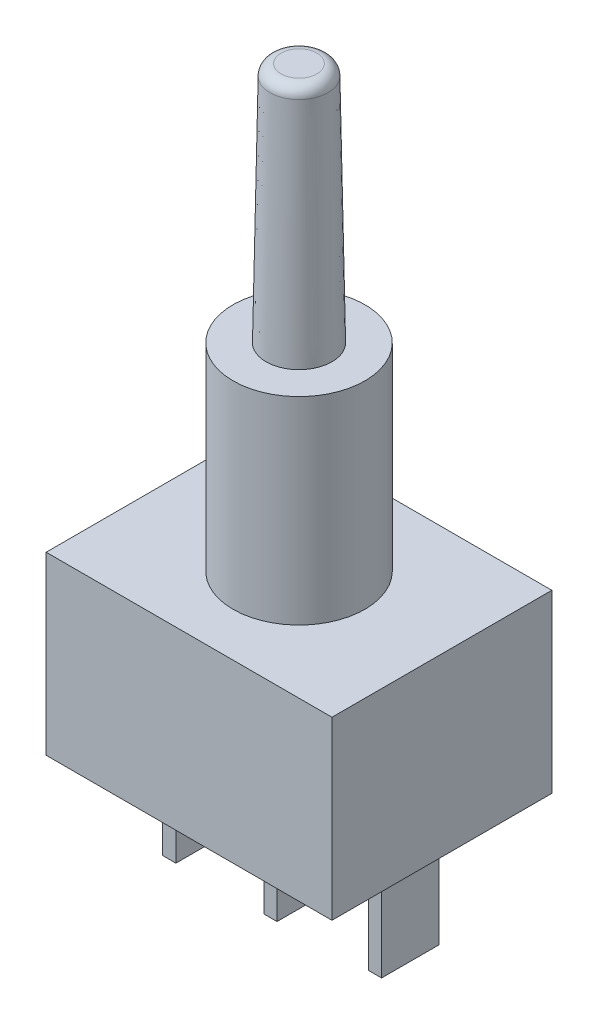
from build123d import *

# Parameters (mm, degrees)
SKETCH_1_W      = 13
SKETCH_1_H      = 10
EXTRUDE_1_DEPTH = 8
SKETCH_2_R      = 3
EXTRUDE_2_DEPTH = 9
SKETCH_6_R      = 1.5
EXTRUDE_3_DEPTH = 11
EXTRUDE_3_TAPER = 1
FILLET_1_R      = 0.5
SKETCH_7_W      = 0.6
SKETCH_7_H      = 2.6
EXTRUDE_4_DEPTH = 5


with BuildPart() as part:
    # 草图1 → 凸台-拉伸1 (new body)
    with BuildSketch(Plane(origin=(0, 0, 0), x_dir=(1, 0, 0), z_dir=(0, 1, 0))):
        Rectangle(SKETCH_1_W, SKETCH_1_H)
    extrude(amount=EXTRUDE_1_DEPTH)

    # 草图2 → 凸台-拉伸2 (add)
    with BuildSketch(Plane(origin=(0, 8, 0), x_dir=(1, 0, 0), z_dir=(0, 1, 0))):
        with Locations(Location((0, 0, 0), (0, 0, 270))):
            Circle(SKETCH_2_R)
    extrude(amount=EXTRUDE_2_DEPTH)

    # 草图6 → 凸台-拉伸3 (add)
    with BuildSketch(Plane(origin=(0, 17, 0), x_dir=(1, 0, 0), z_dir=(0, 1, 0))):
        Circle(SKETCH_6_R)
    extrude(amount=EXTRUDE_3_DEPTH, taper=EXTRUDE_3_TAPER)

    # 圆角1
    fillet_1_edges = [part.edges().sort_by_distance(p)[0] for p in [
        (-1.307994286, 28, 0),
    ]]
    fillet(fillet_1_edges, radius=FILLET_1_R)

    # 草图7 → 凸台-拉伸4 (add)
    with BuildSketch(Plane.XZ):
        with Locations((-4.6, 0)):
            Rectangle(SKETCH_7_W, SKETCH_7_H)
        Rectangle(SKETCH_7_W, SKETCH_7_H)
        with Locations((4.6, -0.156510549)):
            Rectangle(SKETCH_7_W, SKETCH_7_H)
    extrude(amount=EXTRUDE_4_DEPTH)


solid = part.part
